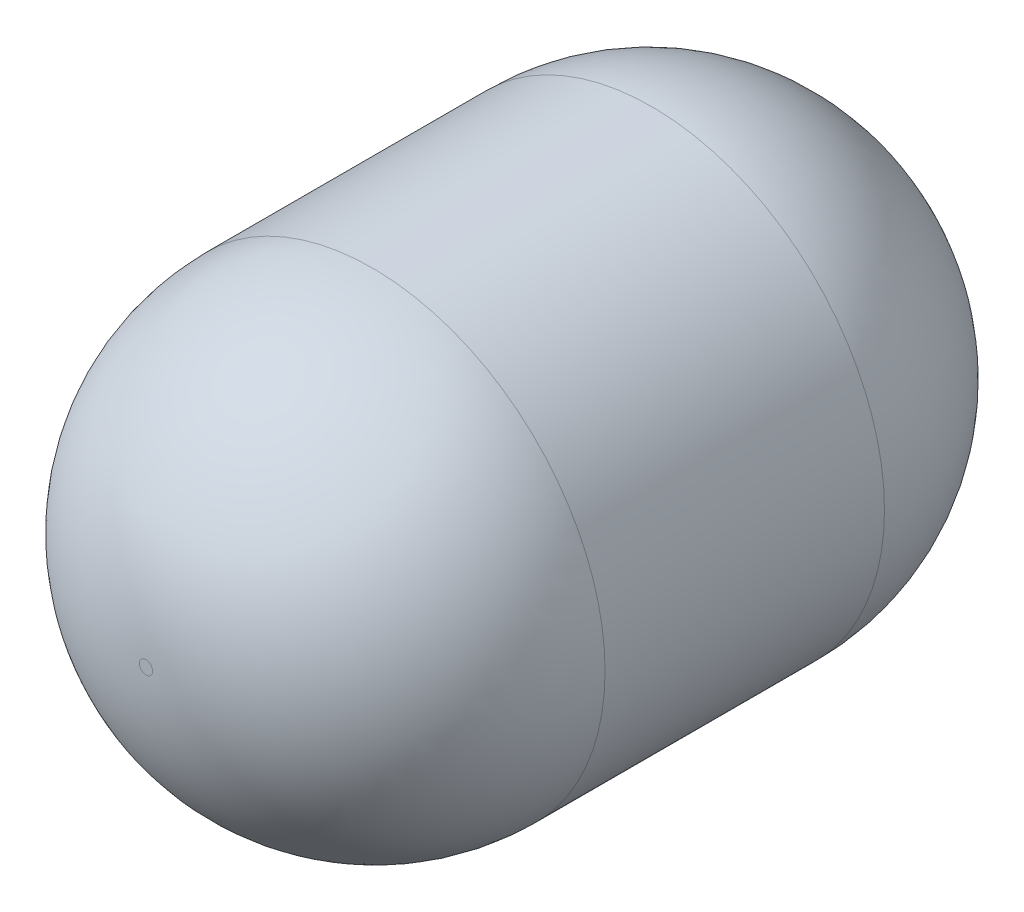
from build123d import *

# Parameters (mm, degrees)
SKETCH1_R           = 35
BOSS_EXTRUDE1_DEPTH = 110
FILLET1_R           = 34


with BuildPart() as part:
    # Sketch1 → Boss-Extrude1 (new body)
    with BuildSketch(Plane.XY):
        Circle(SKETCH1_R)
    extrude(amount=BOSS_EXTRUDE1_DEPTH)

    # Fillet1
    fillet1_edges = [part.edges().sort_by_distance(p)[0] for p in [
        (-35, 0, 0),
        (-35, 0, 110),
    ]]
    fillet(fillet1_edges, radius=FILLET1_R)


solid = part.part
